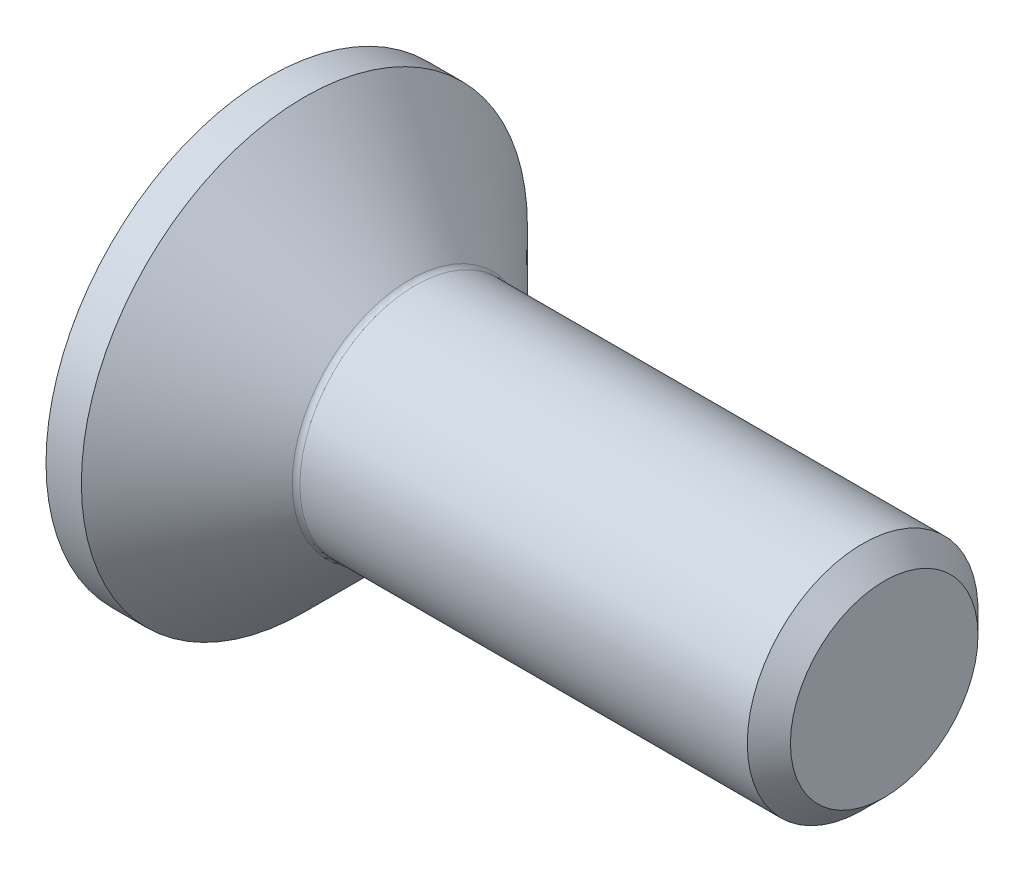
from build123d import *

# Parameters (mm, degrees)
FILLET1_R   = 0.1
HEX_2_DEPTH = 1.1


with BuildPart() as part:
    # BodySke → BaseBody (revolve)
    with BuildSketch(Plane.XY, mode=Mode.PRIVATE) as basebody_sk:
        Polygon((0, 0), (0, 2.9), (0.46, 2.9), (1.86, 1.5), (7.7195, 1.5), (8, 1.2195), (8, 0), align=None)
    revolve(basebody_sk.sketch.rotate(Axis((0, 0, 0), (1, 0, 0)), 90), axis=Axis((0, 0, 0), (1, 0, 0)))

    # Fillet1
    fillet1_edges = [part.edges().sort_by_distance(p)[0] for p in [
        (1.86, 0, -1.5),
    ]]
    fillet(fillet1_edges, radius=FILLET1_R)

    # Sketch2 → PreBroach (revolve, cut)
    with BuildSketch(Plane.XY, mode=Mode.PRIVATE) as prebroach_sk:
        Polygon((0, 1), (1.1, 1), (1.677350269, 0), (0, 0), align=None)
    revolve(prebroach_sk.sketch.rotate(Axis((0, 0, 0), (1, 0, 0)), 90), axis=Axis((0, 0, 0), (1, 0, 0)), mode=Mode.SUBTRACT)

    # Sketch3 → Hex 2 (cut)
    with BuildSketch(Plane.ZY):
        Polygon((-1, -0.577350269), (-1, 0.577350269), (0, 1.154700538), (1, 0.577350269), (1, -0.577350269), (0, -1.154700538), align=None)
    extrude(amount=-HEX_2_DEPTH, mode=Mode.SUBTRACT)


solid = part.part
